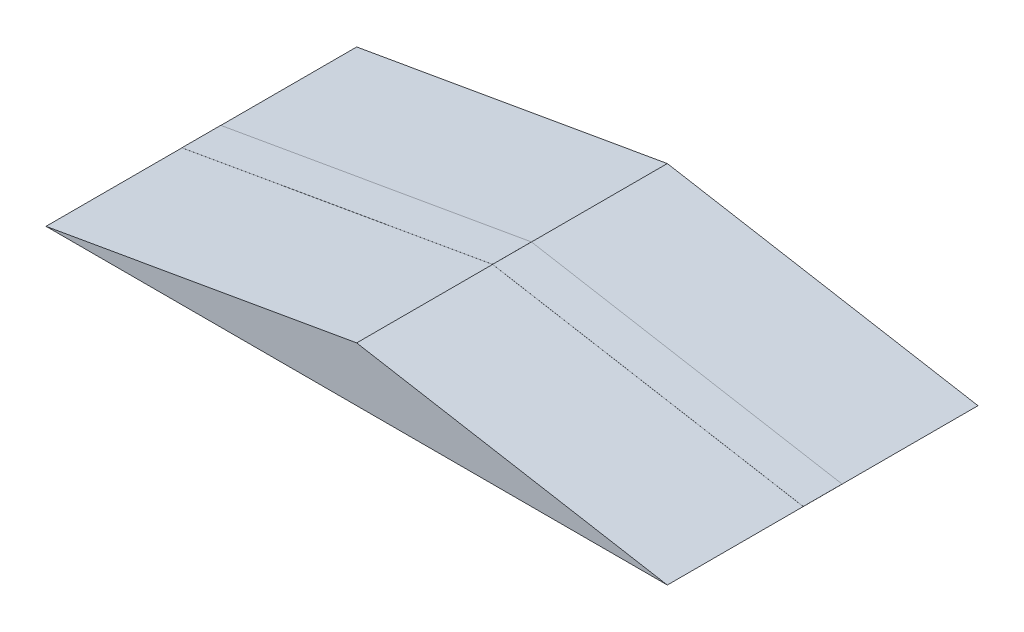
from build123d import *

# Parameters (mm, degrees)
EXTRUDE_1_DEPTH = 400
SKETCH_2_W      = 406.078810085
SKETCH_2_H      = 50
EXTRUDE_2_DEPTH = 0.1


with BuildPart() as part:
    # Эскиз1 → Бобышка-Вытянуть1 (new body)
    with BuildSketch(Plane.XY):
        Polygon((-400, 0), (400, 0), (0, 70), align=None)
    extrude(amount=EXTRUDE_1_DEPTH)

    # Эскиз2 → Бобышка-Вытянуть2 (add)
    with BuildSketch(Plane(origin=(11.88599151, 67.919951486, 0), x_dir=(0.9850304671557042, -0.17238033175224823, 0), z_dir=(0.17238033175224823, 0.9850304671557042, 0))):
        with Locations((190.972781819, -200)):
            Rectangle(SKETCH_2_W, SKETCH_2_H)
    extrude_2 = extrude(amount=EXTRUDE_2_DEPTH)

    # Зеркальное отражение1: Бобышка-Вытянуть2 across plane
    add(extrude_2.mirror(Plane(origin=(0, 0, 0), x_dir=(0, 0, 1), z_dir=(1, 0, 0))))


solid = part.part
